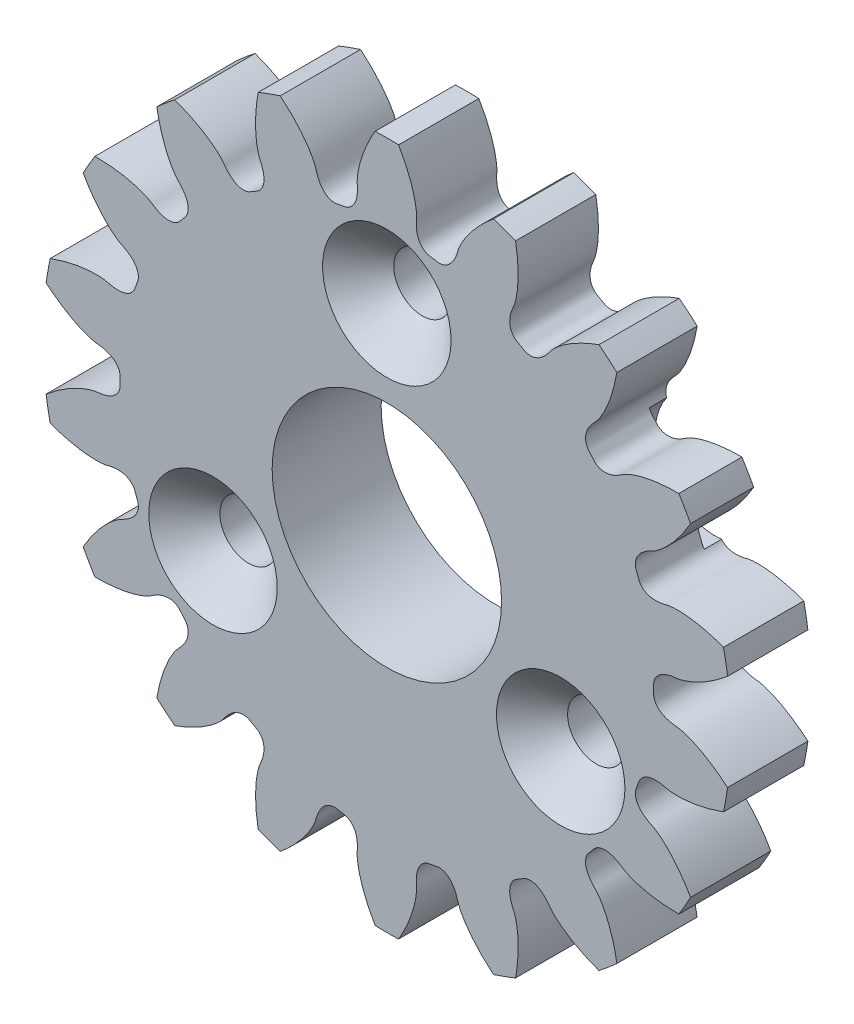
from build123d import *

# Parameters (mm, degrees)
SKETCH_370_W               = 7
SKETCH_370_H               = 29.999999549
CUT_EXTRUDE_565_DEPTH      = 3.5
PATTERN_CIRCULAR_617_COUNT = 18
SKETCH_664_W               = 7
SKETCH_664_H               = 6.349999905
SKETCH_1_R                 = 2.5
CUT_EXTRUDE_1_DEPTH        = 10
SKETCH_5_R                 = 10
CUT_EXTRUDE_2_DEPTH        = 43.794422905
SKETCH_6_R                 = 13
SKETCH_6_R_2               = 10
EXTRUDE_2_DEPTH            = 2.5
SKETCH_7_R                 = 5.25
CUT_EXTRUDE_3_DEPTH        = 1.5
HOLE_WIZARD_2_D            = 5
HOLE_WIZARD_2_CSINK_D      = 11.2
HOLE_WIZARD_2_CSINK_ANGLE  = 90


with BuildPart() as part:
    # Sketch 370 → Revolve 397 (revolve)
    with BuildSketch(Plane(origin=(0, 0, 0), x_dir=(0, 0, -1), z_dir=(1, 0, 0)), mode=Mode.PRIVATE) as revolve_397_sk:
        with Locations((0, 14.999999775)):
            Rectangle(SKETCH_370_W, SKETCH_370_H)
    revolve(revolve_397_sk.sketch.rotate(Axis((0, 0, 0), (0, 0, -1)), 90), axis=Axis((0, 0, 0), (0, 0, -1)))

    # Sketch 440 → Cut-Extrude 565 (cut, symmetric)
    with BuildSketch(Plane.XY):
        with BuildLine():
            ThreePointArc((29.839568017, 4.31539723), (30.149999547, 0), (29.839568017, -4.31539723))
            add(Edge.make_bspline(
                [(29.839568017, -4.31539723), (29.474097393, -3.998633475), (28.981853035, -3.608411385), (28.353594575, -3.176302467), (28.012511151, -2.957482029), (27.687034555, -2.763112194), (27.378360013, -2.591953268), (27.087618376, -2.442713193), (26.815874577, -2.314052381), (26.564125624, -2.204586196), (26.333298882, -2.112887915), (26.124250376, -2.037492238), (25.937763398, -1.976896926), (25.774546735, -1.929570618), (25.635234547, -1.893942219), (25.520381896, -1.868444488), (25.430472897, -1.851407093), (25.365896398, -1.841342663), (25.326997442, -1.836321539), (25.250427682, -1.829339489), (25.158576865, -1.822153591), (25.043834102, -1.808014301), (24.96110265, -1.796354899), (24.87991604, -1.783145646), (24.800243734, -1.768448682), (24.722059582, -1.752230325), (24.645331901, -1.734473147), (24.570026, -1.715145137), (24.496103552, -1.694206042), (24.423522944, -1.671603658), (24.3522396, -1.64727243), (24.282206634, -1.621131062), (24.213375868, -1.593079974), (24.145699388, -1.562998364), (24.079131817, -1.530740955), (24.01363356, -1.496134451), (23.949175351, -1.458973865), (23.885744474, -1.419018952), (23.823353126, -1.375991181), (23.762049409, -1.329571946), (23.701931404, -1.279403053), (23.643164575, -1.225090991), (23.586002345, -1.166217007), (23.530808867, -1.102355465), (23.478081638, -1.033103211), (23.428469994, -0.958122155), (23.382782603, -0.877195818), (23.341978058, -0.790296784), (23.30712162, -0.697658983), (23.279336005, -0.599834846), (23.259617653, -0.497743843), (23.249862081, -0.400839709), (23.245654699, -0.234614076), (23.253438438, 0), (23.245654699, 0.234614076), (23.249862081, 0.400839709), (23.259617653, 0.497743843), (23.279336005, 0.599834846), (23.30712162, 0.697658983), (23.341978058, 0.790296784), (23.382782603, 0.877195818), (23.428469994, 0.958122155), (23.478081638, 1.033103211), (23.530808867, 1.102355465), (23.586002345, 1.166217007), (23.643164575, 1.225090991), (23.701931404, 1.279403053), (23.762049409, 1.329571946), (23.823353126, 1.375991181), (23.885744474, 1.419018952), (23.949175351, 1.458973865), (24.01363356, 1.496134451), (24.079131817, 1.530740955), (24.145699388, 1.562998364), (24.213375868, 1.593079974), (24.282206634, 1.621131062), (24.3522396, 1.64727243), (24.423522944, 1.671603658), (24.496103552, 1.694206042), (24.570026, 1.715145137), (24.645331901, 1.734473147), (24.722059582, 1.752230325), (24.800243734, 1.768448682), (24.87991604, 1.783145646), (24.96110265, 1.796354899), (25.043834102, 1.808014301), (25.158576865, 1.822153591), (25.250427682, 1.829339489), (25.326997442, 1.836321539), (25.365896398, 1.841342663), (25.430472897, 1.851407093), (25.520381896, 1.868444488), (25.635234547, 1.893942219), (25.774546735, 1.929570618), (25.937763398, 1.976896926), (26.124250376, 2.037492238), (26.333298882, 2.112887915), (26.564125624, 2.204586196), (26.815874577, 2.314052381), (27.087618376, 2.442713193), (27.378360013, 2.591953268), (27.687034555, 2.763112194), (28.012511151, 2.957482029), (28.353594575, 3.176302467), (28.981853035, 3.608411385), (29.474097393, 3.998633475), (29.839568017, 4.31539723)],
                knots=[0, 0, 0, 0, 0.086681892, 0.112454454, 0.136665043, 0.159313658, 0.1804003, 0.199924969, 0.217887664, 0.234288386, 0.249127134, 0.262403909, 0.274118711, 0.284271539, 0.292862394, 0.299891276, 0.305358185, 0.30926312, 0.311606084, 0.312387082, 0.323045666, 0.328117752, 0.333108821, 0.33802219, 0.342861525, 0.34763088, 0.352334746, 0.356978107, 0.3615665, 0.366106083, 0.370603711, 0.375067019, 0.379504513, 0.383925662, 0.388341001, 0.39276222, 0.397202256, 0.401675347, 0.406197062, 0.410784251, 0.415454908, 0.420227881, 0.425122382, 0.430157244, 0.435349849, 0.44071472, 0.446261769, 0.451994334, 0.45790724, 0.46398525, 0.470202375, 0.476522482, 0.481418853, 0.5, 0.518581147, 0.523477518, 0.529797625, 0.53601475, 0.54209276, 0.548005666, 0.553738231, 0.55928528, 0.564650151, 0.569842756, 0.574877618, 0.579772119, 0.584545092, 0.589215749, 0.593802938, 0.598324653, 0.602797744, 0.60723778, 0.611658999, 0.616074338, 0.620495487, 0.624932981, 0.629396289, 0.633893917, 0.6384335, 0.643021893, 0.647665254, 0.65236912, 0.657138475, 0.66197781, 0.666891179, 0.671882248, 0.676954334, 0.687612918, 0.688393916, 0.69073688, 0.694641815, 0.700108724, 0.707137606, 0.715728461, 0.725881289, 0.737596091, 0.750872866, 0.765711614, 0.782112336, 0.800075031, 0.8195997, 0.840686342, 0.863334957, 0.887545546, 0.913318108, 1, 1, 1, 1], degree=3))
        make_face()
    cut_extrude_565 = extrude(amount=CUT_EXTRUDE_565_DEPTH, both=True, mode=Mode.SUBTRACT)

    # Pattern Circular 617: Cut-Extrude 565 ×18 about axis
    pattern_circular_617_axis = Axis((0, 0, 55), (0, 0, -1))
    for i in range(1, PATTERN_CIRCULAR_617_COUNT):
        add(cut_extrude_565.rotate(pattern_circular_617_axis, i * 360 / PATTERN_CIRCULAR_617_COUNT), mode=Mode.SUBTRACT)

    # Sketch 664 → Cut-Revolve 706 (revolve, cut)
    with BuildSketch(Plane(origin=(0, 0, 0), x_dir=(0, 0, -1), z_dir=(1, 0, 0)), mode=Mode.PRIVATE) as cut_revolve_706_sk:
        with Locations((0, 3.174999953)):
            Rectangle(SKETCH_664_W, SKETCH_664_H)
    revolve(cut_revolve_706_sk.sketch.rotate(Axis((0, 0, 0), (0, 0, -1)), 90), axis=Axis((0, 0, 0), (0, 0, -1)), mode=Mode.SUBTRACT)

    # 草图1 → 切除-拉伸1 (cut)
    with BuildSketch(Plane.XY.offset(3.5)):
        with Locations((0, 17.5)):
            Circle(SKETCH_1_R)
        with Locations((15.155444566, -8.75)):
            Circle(SKETCH_1_R)
        with Locations((-15.155444566, -8.75)):
            Circle(SKETCH_1_R)
    extrude(amount=-CUT_EXTRUDE_1_DEPTH, mode=Mode.SUBTRACT)

    # 草图5 → 切除-拉伸2 (cut, through all)
    with BuildSketch(Plane.XY.offset(3.5)):
        Circle(SKETCH_5_R)
    extrude(amount=-CUT_EXTRUDE_2_DEPTH, mode=Mode.SUBTRACT)

    # 草图6 → 凸台-拉伸2 (add)
    with BuildSketch(Plane(origin=(0, 0, -3.5), x_dir=(-1, 0, 0), z_dir=(0, 0, -1))):
        with Locations(Location((0, 0, 0), (0, 0, 180))):
            Circle(SKETCH_6_R)
        with Locations(Location((0, 0, 0), (0, 0, 180))):
            Circle(SKETCH_6_R_2, mode=Mode.SUBTRACT)
    extrude(amount=EXTRUDE_2_DEPTH)

    # 草图7 → 切除-拉伸3 (cut)
    with BuildSketch(Plane(origin=(0, 0, -3.5), x_dir=(-1, 0, 0), z_dir=(0, 0, -1))):
        with Locations((0, -25)):
            Circle(SKETCH_7_R)
        with Locations((-21.650635095, 12.5)):
            Circle(SKETCH_7_R)
        with Locations((21.650635095, 12.5)):
            Circle(SKETCH_7_R)
    extrude(amount=-CUT_EXTRUDE_3_DEPTH, mode=Mode.SUBTRACT)

    # 打孔尺寸(%根据十字)槽沉头木螺钉的类型2 (through all)
    with Locations(Plane(origin=(0, 17.5, 3.5), x_dir=(1, 0, 0), z_dir=(0, 0, 1))):
        with Locations((0, 0), (-15.155444566, -26.25), (15.155444566, -26.25)):
            CounterSinkHole(HOLE_WIZARD_2_D / 2, HOLE_WIZARD_2_CSINK_D / 2, counter_sink_angle=HOLE_WIZARD_2_CSINK_ANGLE)


solid = part.part
